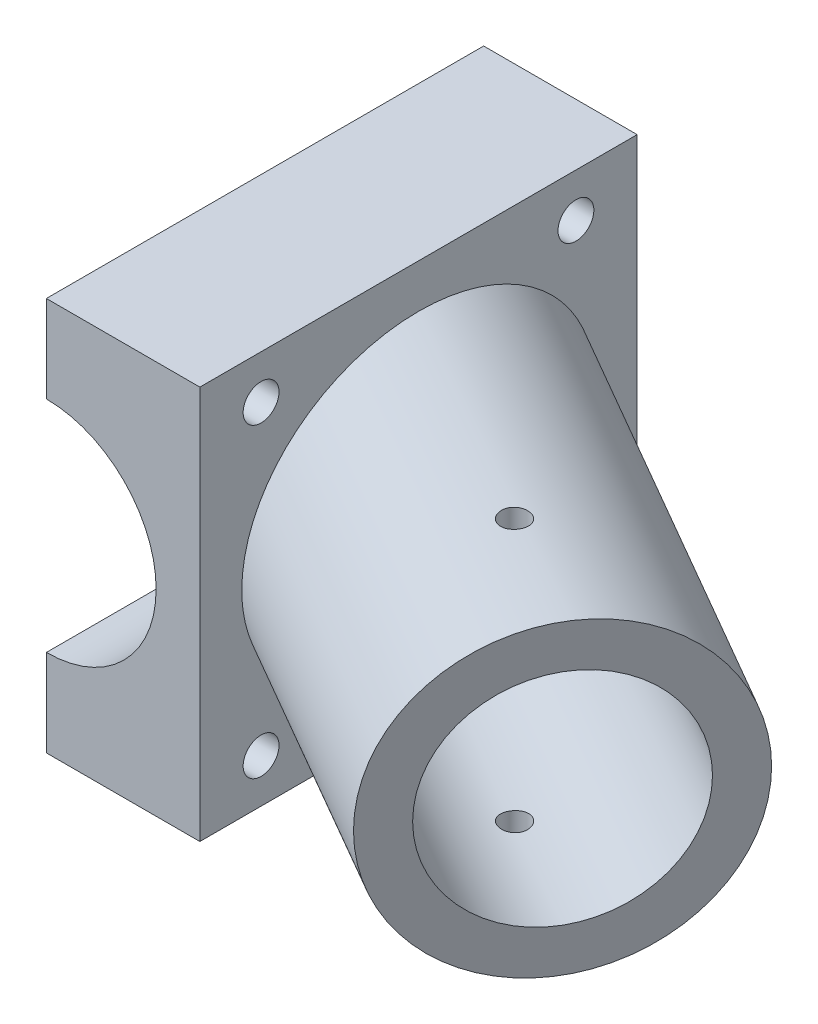
from build123d import *
from build123d.topology import SkipClean

# Parameters (mm, degrees)
BOSS_EXTRUDE1_DEPTH             = 25
BOSS_EXTRUDE2_REACH             = 65.436
BOSS_EXTRUDE2_DIRECTION_2_DEPTH = 30
SKETCH9_R                       = 2.05
CUT_EXTRUDE3_DEPTH              = 35.1
BOSS_EXTRUDE5_REACH             = 63.632
SKETCH13_R                      = 1.55
CUT_EXTRUDE4_DEPTH              = 88.768186926
SKETCH16_W                      = 50
SKETCH16_H                      = 45
CUT_EXTRUDE5_DEPTH              = 17.55


with BuildPart() as part:
    # Sketch1 → Boss-Extrude1 (new, symmetric)
    with BuildSketch(Plane.XY):
        with BuildLine():
            Line((-17.55, 22.5), (-17.55, 0))
            Line((-17.55, 0), (17.55, 0))
            Line((17.55, 0), (17.55, 22.5))
            Line((17.55, 22.5), (12.55, 22.5))
            ThreePointArc((12.55, 22.5), (0, 9.95), (-12.55, 22.5))
            Line((-12.55, 22.5), (-17.55, 22.5))
        make_face()
    boss_extrude1 = extrude(amount=BOSS_EXTRUDE1_DEPTH, both=True)

    # Boss-Extrude2: up to this face of the body (flat: up to its plane)
    boss_extrude2_end = Plane(part.part.faces().sort_by_distance((17.55, 11.25, 0))[0])
    # Sketch5 → Boss-Extrude2 (add, up to the picked face)
    with BuildSketch(Plane(origin=(26.152881057, 0, 15.099372918), x_dir=(0.500000000000001, 0, -0.8660254037844382), z_dir=(0.8660254037844382, 0, 0.500000000000001)), mode=Mode.PRIVATE) as boss_extrude2_sk1:
        with BuildLine():
            Line((-8.725, 22.5), (-3.775, 22.5))
            ThreePointArc((-3.775, 22.5), (8.775, 9.95), (21.325, 22.5))
            Line((21.325, 22.5), (26.275, 22.5))
            ThreePointArc((26.275, 22.5), (8.775, 5), (-8.725, 22.5))
        make_face()
    boss_extrude2_tool1 = split(extrude(boss_extrude2_sk1.sketch, amount=-BOSS_EXTRUDE2_REACH, mode=Mode.PRIVATE), bisect_by=boss_extrude2_end, keep=Keep.BOTH, mode=Mode.PRIVATE)
    boss_extrude2 = boss_extrude2_tool1.solids().sort_by(Axis((23.027881, 22.108688, 20.512032), (-0.8660254037844382, 0, -0.500000000000001)))[0]
    add(boss_extrude2)

    # Sketch5 → Boss-Extrude2 direction 2 (add)
    with BuildSketch(Plane(origin=(26.152881057, 0, 15.099372918), x_dir=(0.500000000000001, 0, -0.8660254037844382), z_dir=(0.8660254037844382, 0, 0.500000000000001))):
        with BuildLine():
            Line((-8.725, 22.5), (-3.775, 22.5))
            ThreePointArc((-3.775, 22.5), (8.775, 9.95), (21.325, 22.5))
            Line((21.325, 22.5), (26.275, 22.5))
            ThreePointArc((26.275, 22.5), (8.775, 5), (-8.725, 22.5))
        make_face()
    boss_extrude2_direction_2 = extrude(amount=BOSS_EXTRUDE2_DIRECTION_2_DEPTH)

    # Sketch9 → Cut-Extrude3 (cut)
    with BuildSketch(Plane.ZY.offset(17.55)):
        with Locations((-18, 5)):
            Circle(SKETCH9_R)
        with Locations((18, 5)):
            Circle(SKETCH9_R)
    cut_extrude3 = extrude(amount=-CUT_EXTRUDE3_DEPTH, mode=Mode.SUBTRACT)

    # Boss-Extrude5: up to this face of the body (flat: up to its plane)
    boss_extrude5_end = Plane(part.part.faces().sort_by_distance((17.55, 17.173614571, 0))[0])
    # Sketch12 → Boss-Extrude5 (add, up to the picked face)
    with BuildSketch(Plane(origin=(22.035576211, 0, 12.722245857), x_dir=(0.4999999999999999, 0, -0.8660254037844388), z_dir=(0.8660254037844388, 0, 0.4999999999999999)), mode=Mode.PRIVATE) as boss_extrude5_sk1:
        with BuildLine():
            Line((-3.775, 22.5), (21.325, 22.5))
            ThreePointArc((21.325, 22.5), (8.775, 9.95), (-3.775, 22.5))
        make_face()
    boss_extrude5_tool1 = split(extrude(boss_extrude5_sk1.sketch, amount=-BOSS_EXTRUDE5_REACH, mode=Mode.PRIVATE), bisect_by=boss_extrude5_end, keep=Keep.BOTH, mode=Mode.PRIVATE)
    boss_extrude5 = boss_extrude5_tool1.solids().sort_by(Axis((26.423076, 17.173615, 5.122873), (-0.8660254037844388, 0, -0.4999999999999999)))[0]
    add(boss_extrude5)


with BuildPart() as mirror1_1:
    # Mirror1: Boss-Extrude1, Boss-Extrude2, Boss-Extrude2 direction 2 across plane
    add(boss_extrude1.mirror(Plane(origin=(17.55, 22.5, 25), x_dir=(0, 0, 1), z_dir=(0, -1, 0))))
    add(boss_extrude2.mirror(Plane(origin=(17.55, 22.5, 25), x_dir=(0, 0, 1), z_dir=(0, -1, 0))))
    add(boss_extrude2_direction_2.mirror(Plane(origin=(17.55, 22.5, 25), x_dir=(0, 0, 1), z_dir=(0, -1, 0))))

    # Mirror1 2: Cut-Extrude3 across plane
    add(cut_extrude3.mirror(Plane(origin=(17.55, 22.5, 25), x_dir=(0, 0, 1), z_dir=(0, -1, 0))), mode=Mode.SUBTRACT)


with BuildPart() as mirror1_3_1:
    # Mirror1 3: Boss-Extrude5 across plane
    add(boss_extrude5.mirror(Plane(origin=(17.55, 22.5, 25), x_dir=(0, 0, 1), z_dir=(0, -1, 0))))


with BuildPart() as part_1:
    add(part.part)

    # Mirror1 united with what the copies touc: union Mirror1_1, Mirror1 3_1
    add(mirror1_1.part)
    add(mirror1_3_1.part)

    # Sketch13 → Cut-Extrude4 (cut, through all)
    with SkipClean():  # the faces are left unmerged after this step: merging them gives an invalid solid
        with BuildSketch(Plane(origin=(0, 0, 0), x_dir=(1, 0, 0), z_dir=(0, 1, 0))):
            with Locations(Location((43.530762114, -15, 0), (0, 0, 90))):
                Circle(SKETCH13_R)
        extrude(amount=CUT_EXTRUDE4_DEPTH, mode=Mode.SUBTRACT)

    # Sketch16 → Cut-Extrude5 (cut)
    with BuildSketch(Plane(origin=(0, 0, 0), x_dir=(0, 0, -1), z_dir=(1, 0, 0))):
        with Locations((0, 22.5)):
            Rectangle(SKETCH16_W, SKETCH16_H)
    extrude(amount=-CUT_EXTRUDE5_DEPTH, mode=Mode.SUBTRACT)


solid = part_1.part
